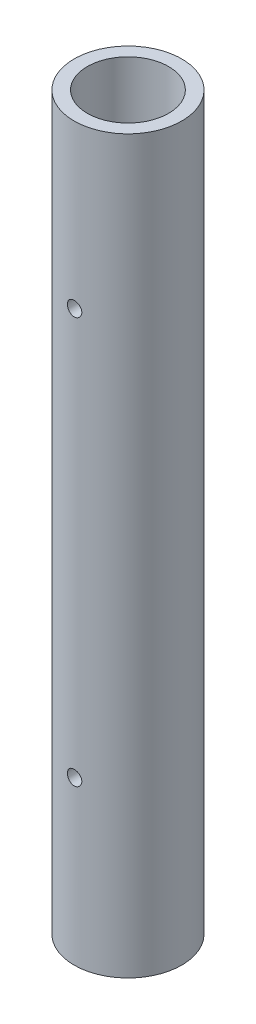
from build123d import *

# Parameters (mm, degrees)
SKETCH1_R               = 16.8275
SKETCH1_R_2             = 12.7
BOSS_EXTRUDE1_DEPTH     = 228.6
CUT_EXTRUDE1_DEPTH      = 230.835353052
CUT_EXTRUDE1_DEPTH_BACK = 230.835353052
SKETCH2_R               = 2.2479


with BuildPart() as part:
    # Sketch1 → Boss-Extrude1 (new body)
    with BuildSketch(Plane(origin=(0, 0, 0), x_dir=(1, 0, 0), z_dir=(0, 1, 0))):
        with Locations(Location((0, 0, 0), (0, 0, 270))):
            Circle(SKETCH1_R)
        with Locations(Location((0, 0, 0), (0, 0, 270))):
            Circle(SKETCH1_R_2, mode=Mode.SUBTRACT)
    extrude(amount=BOSS_EXTRUDE1_DEPTH)

    # Sketch2 → Cut-Extrude1 (cut, two sides: drawn at the far end of the back side and taken through both)
    with BuildSketch(Plane.XY.offset(-CUT_EXTRUDE1_DEPTH_BACK)):
        with Locations((0, 177.8)):
            Circle(SKETCH2_R)
        with Locations((0, 50.8)):
            Circle(SKETCH2_R)
    extrude(amount=CUT_EXTRUDE1_DEPTH + CUT_EXTRUDE1_DEPTH_BACK, mode=Mode.SUBTRACT)


solid = part.part
